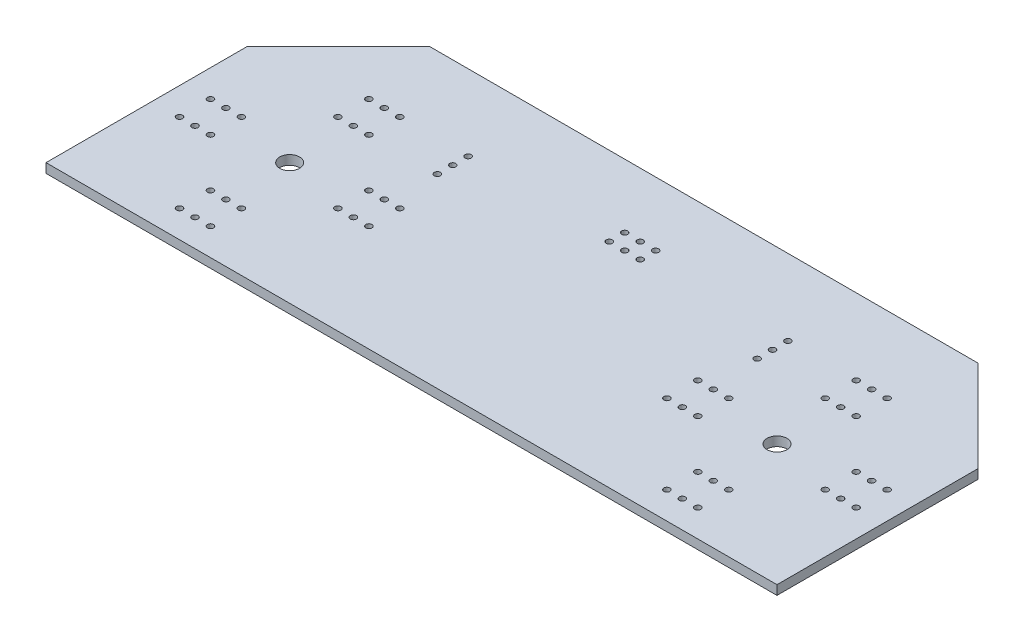
from build123d import *

# Parameters (mm, degrees)
SKETCH1_W           = 120
SKETCH1_H           = 48
BOSS_EXTRUDE1_DEPTH = 1.53
SKETCH2_R           = 0.5
SKETCH2_R_2         = 1.625
CUT_EXTRUDE1_DEPTH  = 67.229456437
SKETCH5_R           = 0.5
CUT_EXTRUDE2_DEPTH  = 67.229456437
CUT_EXTRUDE4_DEPTH  = 67.229456437
SKETCH7_R           = 0.5
CUT_EXTRUDE5_DEPTH  = 67.229456437


with BuildPart() as part:
    # Sketch1 → Boss-Extrude1 (new body)
    with BuildSketch(Plane(origin=(0, 0, 0), x_dir=(1, 0, 0), z_dir=(0, 1, 0))):
        with Locations((0, 4)):
            Rectangle(SKETCH1_W, SKETCH1_H)
    extrude(amount=BOSS_EXTRUDE1_DEPTH)

    # Sketch2 → Cut-Extrude1 (cut, through all)
    with BuildSketch(Plane(origin=(0, 1.53, 0), x_dir=(1, 0, 0), z_dir=(0, 1, 0))):
        with Locations((-55.54, 2.54)):
            Circle(SKETCH2_R)
        with Locations((-53, 2.54)):
            Circle(SKETCH2_R)
        with Locations((-50.46, 2.54)):
            Circle(SKETCH2_R)
        with Locations((-55.54, -2.54)):
            Circle(SKETCH2_R)
        with Locations((-53, -2.54)):
            Circle(SKETCH2_R)
        with Locations((-50.46, -2.54)):
            Circle(SKETCH2_R)
        with Locations((-29.54, 2.54)):
            Circle(SKETCH2_R)
        with Locations((-27, 2.54)):
            Circle(SKETCH2_R)
        with Locations((-24.46, 2.54)):
            Circle(SKETCH2_R)
        with Locations((-29.54, -2.54)):
            Circle(SKETCH2_R)
        with Locations((-27, -2.54)):
            Circle(SKETCH2_R)
        with Locations((-24.46, -2.54)):
            Circle(SKETCH2_R)
        with Locations((-42.54, 15.54)):
            Circle(SKETCH2_R)
        with Locations((-40, 15.54)):
            Circle(SKETCH2_R)
        with Locations((-37.46, 15.54)):
            Circle(SKETCH2_R)
        with Locations((-42.54, 10.46)):
            Circle(SKETCH2_R)
        with Locations((-40, 10.46)):
            Circle(SKETCH2_R)
        with Locations((-37.46, 10.46)):
            Circle(SKETCH2_R)
        with Locations((-42.54, -10.46)):
            Circle(SKETCH2_R)
        with Locations((-40, -10.46)):
            Circle(SKETCH2_R)
        with Locations((-37.46, -10.46)):
            Circle(SKETCH2_R)
        with Locations((-42.54, -15.54)):
            Circle(SKETCH2_R)
        with Locations((-40, -15.54)):
            Circle(SKETCH2_R)
        with Locations((-37.46, -15.54)):
            Circle(SKETCH2_R)
        with Locations((-40, 0)):
            Circle(SKETCH2_R_2)
    cut_extrude1 = extrude(amount=-CUT_EXTRUDE1_DEPTH, mode=Mode.SUBTRACT)

    # Mirror1: Cut-Extrude1 across plane
    add(cut_extrude1.mirror(Plane(origin=(0, 0, 0), x_dir=(0, 0, 1), z_dir=(1, 0, 0))), mode=Mode.SUBTRACT)

    # Sketch5 → Cut-Extrude2 (cut, through all)
    with BuildSketch(Plane(origin=(0, 1.53, 0), x_dir=(1, 0, 0), z_dir=(0, 1, 0))):
        with Locations((-2.54, 17.54)):
            Circle(SKETCH5_R)
        with Locations((0, 17.54)):
            Circle(SKETCH5_R)
        with Locations((2.54, 17.54)):
            Circle(SKETCH5_R)
        with Locations((-2.54, 15)):
            Circle(SKETCH5_R)
        with Locations((0, 15)):
            Circle(SKETCH5_R)
        with Locations((2.54, 15)):
            Circle(SKETCH5_R)
    extrude(amount=-CUT_EXTRUDE2_DEPTH, mode=Mode.SUBTRACT)

    # Sketch6 → Cut-Extrude4 (cut, through all)
    with BuildSketch(Plane(origin=(0, 1.53, 0), x_dir=(1, 0, 0), z_dir=(0, 1, 0))):
        Polygon((-60, 28), (-45, 28), (-60, 13), align=None)
        Polygon((60, 28), (60, 13), (45, 28), align=None)
    extrude(amount=-CUT_EXTRUDE4_DEPTH, mode=Mode.SUBTRACT)

    # Sketch7 → Cut-Extrude5 (cut, through all)
    with BuildSketch(Plane(origin=(0, 1.53, 0), x_dir=(1, 0, 0), z_dir=(0, 1, 0))):
        with Locations((-26.25, 15.54)):
            Circle(SKETCH7_R)
        with Locations((-26.25, 13.02)):
            Circle(SKETCH7_R)
        with Locations((-26.25, 10.5)):
            Circle(SKETCH7_R)
        with Locations((26.25, 10.5)):
            Circle(SKETCH7_R)
        with Locations((26.25, 13.02)):
            Circle(SKETCH7_R)
        with Locations((26.25, 15.54)):
            Circle(SKETCH7_R)
    extrude(amount=-CUT_EXTRUDE5_DEPTH, mode=Mode.SUBTRACT)


solid = part.part
